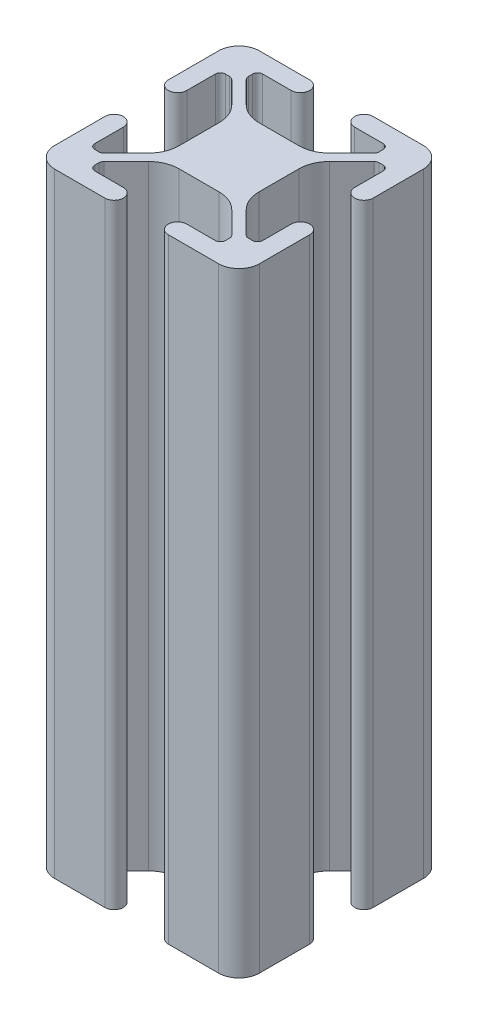
from build123d import *

# Parameters (mm, degrees)
EXTRUDE_1_DEPTH = 60


with BuildPart() as part:
    # 草图1 → 凸台-拉伸1 (new body)
    with BuildSketch(Plane(origin=(0, 0, 0), x_dir=(1, 0, 0), z_dir=(0, 1, 0))):
        with BuildLine():
            Line((-1.042752475, -10.085861632), (3.857247525, -10.085861632))
            ThreePointArc((3.857247525, -10.085861632), (4.757247525, -10.985861632), (3.857247525, -11.885861632))
            Line((3.857247525, -11.885861632), (1.076161722, -11.885861632))
            ThreePointArc((1.076161722, -11.885861632), (0.722608332, -12.032308241), (0.576161722, -12.385861632))
            Line((0.576161722, -12.385861632), (0.576161722, -12.790788968))
            ThreePointArc((0.576161722, -12.790788968), (0.614221956, -12.982130685), (0.722608332, -13.144342359))
            Line((0.722608332, -13.144342359), (2.885447948, -15.307181975))
            ThreePointArc((2.885447948, -15.307181975), (3.858717994, -15.957500229), (5.006768291, -16.185861632))
            Line((5.006768291, -16.185861632), (8.907726758, -16.185861632))
            ThreePointArc((8.907726758, -16.185861632), (10.055777055, -15.957500229), (11.029047102, -15.307181975))
            Line((11.029047102, -15.307181975), (13.191886718, -13.144342359))
            ThreePointArc((13.191886718, -13.144342359), (13.300273094, -12.982130685), (13.338333327, -12.790788968))
            Line((13.338333327, -12.790788968), (13.338333327, -12.385861632))
            ThreePointArc((13.338333327, -12.385861632), (13.191886718, -12.032308241), (12.838333327, -11.885861632))
            Line((12.838333327, -11.885861632), (10.057247525, -11.885861632))
            ThreePointArc((10.057247525, -11.885861632), (9.157247525, -10.985861632), (10.057247525, -10.085861632))
            Line((10.057247525, -10.085861632), (14.957247525, -10.085861632))
            ThreePointArc((14.957247525, -10.085861632), (16.371461087, -10.671648069), (16.957247525, -12.085861632))
            Line((16.957247525, -12.085861632), (16.957247525, -16.985861632))
            ThreePointArc((16.957247525, -16.985861632), (16.057247525, -17.885861632), (15.157247525, -16.985861632))
            Line((15.157247525, -16.985861632), (15.157247525, -14.204775829))
            ThreePointArc((15.157247525, -14.204775829), (15.010800915, -13.851222438), (14.657247525, -13.704775829))
            Line((14.657247525, -13.704775829), (14.252320188, -13.704775829))
            ThreePointArc((14.252320188, -13.704775829), (14.060978472, -13.742836063), (13.898766797, -13.851222438))
            Line((13.898766797, -13.851222438), (11.735927181, -16.014062054))
            ThreePointArc((11.735927181, -16.014062054), (11.085608927, -16.987332101), (10.857247525, -18.135382398))
            Line((10.857247525, -18.135382398), (10.857247525, -22.036340865))
            ThreePointArc((10.857247525, -22.036340865), (11.085608927, -23.184391162), (11.735927181, -24.157661209))
            Line((11.735927181, -24.157661209), (13.898766797, -26.320500825))
            ThreePointArc((13.898766797, -26.320500825), (14.060978472, -26.4288872), (14.252320188, -26.466947434))
            Line((14.252320188, -26.466947434), (14.657247525, -26.466947434))
            ThreePointArc((14.657247525, -26.466947434), (15.010800915, -26.320500825), (15.157247525, -25.966947434))
            Line((15.157247525, -25.966947434), (15.157247525, -23.185861632))
            ThreePointArc((15.157247525, -23.185861632), (16.057247525, -22.285861632), (16.957247525, -23.185861632))
            Line((16.957247525, -23.185861632), (16.957247525, -28.085861632))
            ThreePointArc((16.957247525, -28.085861632), (16.371461087, -29.500075194), (14.957247525, -30.085861632))
            Line((14.957247525, -30.085861632), (10.057247525, -30.085861632))
            ThreePointArc((10.057247525, -30.085861632), (9.157247525, -29.185861632), (10.057247525, -28.285861632))
            Line((10.057247525, -28.285861632), (12.838333327, -28.285861632))
            ThreePointArc((12.838333327, -28.285861632), (13.191886718, -28.139415022), (13.338333327, -27.785861632))
            Line((13.338333327, -27.785861632), (13.338333327, -27.380934295))
            ThreePointArc((13.338333327, -27.380934295), (13.300273094, -27.189592579), (13.191886718, -27.027380904))
            Line((13.191886718, -27.027380904), (11.029047102, -24.864541288))
            ThreePointArc((11.029047102, -24.864541288), (10.055777055, -24.214223034), (8.907726758, -23.985861632))
            Line((8.907726758, -23.985861632), (5.006768291, -23.985861632))
            ThreePointArc((5.006768291, -23.985861632), (3.858717994, -24.214223034), (2.885447948, -24.864541288))
            Line((2.885447948, -24.864541288), (0.722608332, -27.027380904))
            ThreePointArc((0.722608332, -27.027380904), (0.614221956, -27.189592579), (0.576161722, -27.380934295))
            Line((0.576161722, -27.380934295), (0.576161722, -27.785861632))
            ThreePointArc((0.576161722, -27.785861632), (0.722608332, -28.139415022), (1.076161722, -28.285861632))
            Line((1.076161722, -28.285861632), (3.857247525, -28.285861632))
            ThreePointArc((3.857247525, -28.285861632), (4.757247525, -29.185861632), (3.857247525, -30.085861632))
            Line((3.857247525, -30.085861632), (-1.042752475, -30.085861632))
            ThreePointArc((-1.042752475, -30.085861632), (-2.456966038, -29.500075194), (-3.042752475, -28.085861632))
            Line((-3.042752475, -28.085861632), (-3.042752475, -23.185861632))
            ThreePointArc((-3.042752475, -23.185861632), (-2.142752475, -22.285861632), (-1.242752475, -23.185861632))
            Line((-1.242752475, -23.185861632), (-1.242752475, -25.966947434))
            ThreePointArc((-1.242752475, -25.966947434), (-1.096305866, -26.320500825), (-0.742752475, -26.466947434))
            Line((-0.742752475, -26.466947434), (-0.337825138, -26.466947434))
            ThreePointArc((-0.337825138, -26.466947434), (-0.146483422, -26.4288872), (0.015728252, -26.320500825))
            Line((0.015728252, -26.320500825), (2.178567868, -24.157661209))
            ThreePointArc((2.178567868, -24.157661209), (2.828886122, -23.184391162), (3.057247525, -22.036340865))
            Line((3.057247525, -22.036340865), (3.057247525, -18.135382398))
            ThreePointArc((3.057247525, -18.135382398), (2.828886122, -16.987332101), (2.178567868, -16.014062054))
            Line((2.178567868, -16.014062054), (0.015728252, -13.851222438))
            ThreePointArc((0.015728252, -13.851222438), (-0.146483422, -13.742836063), (-0.337825138, -13.704775829))
            Line((-0.337825138, -13.704775829), (-0.742752475, -13.704775829))
            ThreePointArc((-0.742752475, -13.704775829), (-1.096305866, -13.851222438), (-1.242752475, -14.204775829))
            Line((-1.242752475, -14.204775829), (-1.242752475, -16.985861632))
            ThreePointArc((-1.242752475, -16.985861632), (-2.142752475, -17.885861632), (-3.042752475, -16.985861632))
            Line((-3.042752475, -16.985861632), (-3.042752475, -12.085861632))
            ThreePointArc((-3.042752475, -12.085861632), (-2.456966038, -10.671648069), (-1.042752475, -10.085861632))
        make_face()
    extrude(amount=EXTRUDE_1_DEPTH)


solid = part.part
